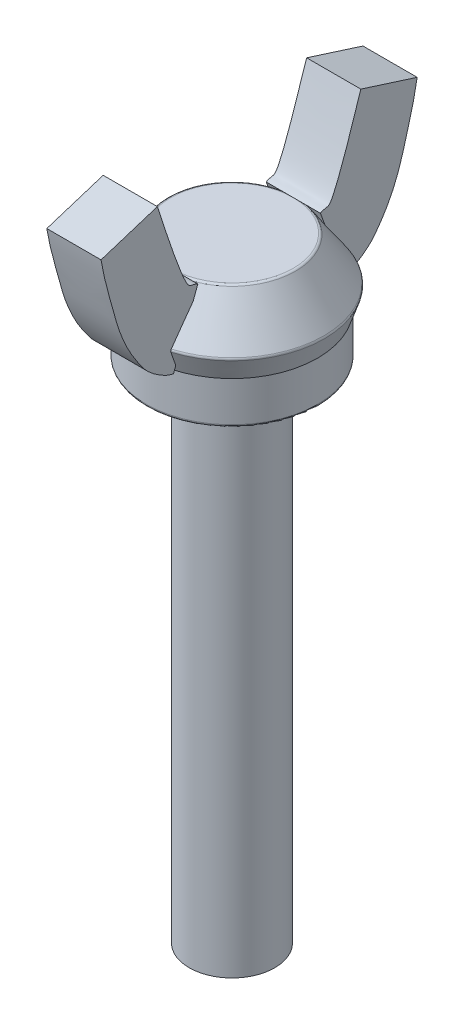
from build123d import *

# Parameters (mm, degrees)
SKETCH_1_R           = 3
EXTRUDE_1_DEPTH      = 35.5
SKETCH_2_R           = 6
EXTRUDE_2_DEPTH      = 3
FILLET_1_R           = 0.2
EXTRUDE_3_DEPTH      = 1.9
EXTRUDE_3_DEPTH_BACK = 1.9


with BuildPart() as part:
    # 스케치1 → 보스-돌출1 (new body)
    with BuildSketch(Plane(origin=(0, 0, 0), x_dir=(1, 0, 0), z_dir=(0, 1, 0))):
        Circle(SKETCH_1_R)
    extrude(amount=EXTRUDE_1_DEPTH)

    # 스케치2 → 보스-돌출2 (add)
    with BuildSketch(Plane(origin=(0, 35.5, 0), x_dir=(1, 0, 0), z_dir=(0, 1, 0))):
        Circle(SKETCH_2_R)
    extrude(amount=EXTRUDE_2_DEPTH)

    # 스케치3 → 회전1 (revolve)
    with BuildSketch(Plane(origin=(0, 0, 0), x_dir=(0, 0, -1), z_dir=(1, 0, 0))):
        Polygon((0, 43.1), (4.4, 43.1), (6.5, 40), (6, 38.5), (0, 38.5), align=None)
    revolve(axis=Axis((0, 38.5, 0), (0, 1, 0)))

    # 필렛1
    fillet_1_edges = [part.edges().sort_by_distance(p)[0] for p in [
        (0, 43.1, 4.4),
        (0, 40, 6.5),
        (-6, 35.5, 0),
    ]]
    fillet(fillet_1_edges, radius=FILLET_1_R)

    # 스케치4 → 보스-돌출3 (add, two sides: drawn at the far end of the back side and taken through both)
    with BuildSketch(Plane(origin=(0, 0, 0), x_dir=(0, 0, -1), z_dir=(1, 0, 0)).offset(-EXTRUDE_3_DEPTH_BACK)):
        with BuildLine():
            Line((7.129672899, 49.216052305), (11.078140475, 47.958388396))
            add(Edge.make_bspline(
                [(11.078140475, 47.958388396), (10.847677477, 46.568474241), (10.449817168, 45.302296098), (9.907358884, 43.260826265), (9.311295548, 41.6663192), (8.235465928, 40.02121413), (7.619812039, 39.286169598), (6.4951686, 38.593529849), (6, 38.5)],
                knots=[0, 0, 0, 0, 0.303156728, 0.355873298, 0.527165706, 0.682347727, 0.853387488, 1, 1, 1, 1], degree=3))
            Line((6, 38.5), (4.293914255, 43.1))
            add(Edge.make_bspline(
                [(4.293914255, 43.1), (4.703822543, 43.319985303), (4.99322637, 42.768371987), (6.293739819, 46.611799248), (7.129672899, 49.216052305)],
                knots=[0, 0, 0, 0, 0.337975892, 1, 1, 1, 1], degree=3))
        make_face()
        with BuildLine():
            Line((-4.293914255, 43.1), (-6, 38.5))
            add(Edge.make_bspline(
                [(-11.078140475, 47.958388396), (-10.847677477, 46.568474241), (-10.449817168, 45.302296098), (-9.907358884, 43.260826265), (-9.311295548, 41.6663192), (-8.235465928, 40.02121413), (-7.619812039, 39.286169598), (-6.4951686, 38.593529849), (-6, 38.5)],
                knots=[0, 0, 0, 0, 0.303156728, 0.355873298, 0.527165706, 0.682347727, 0.853387488, 1, 1, 1, 1], degree=3))
            Line((-11.078140475, 47.958388396), (-7.129672899, 49.216052305))
            add(Edge.make_bspline(
                [(-4.293914255, 43.1), (-4.703822543, 43.319985303), (-4.99322637, 42.768371987), (-6.293739819, 46.611799248), (-7.129672899, 49.216052305)],
                knots=[0, 0, 0, 0, 0.337975892, 1, 1, 1, 1], degree=3))
        make_face()
    extrude(amount=EXTRUDE_3_DEPTH + EXTRUDE_3_DEPTH_BACK)


solid = part.part
